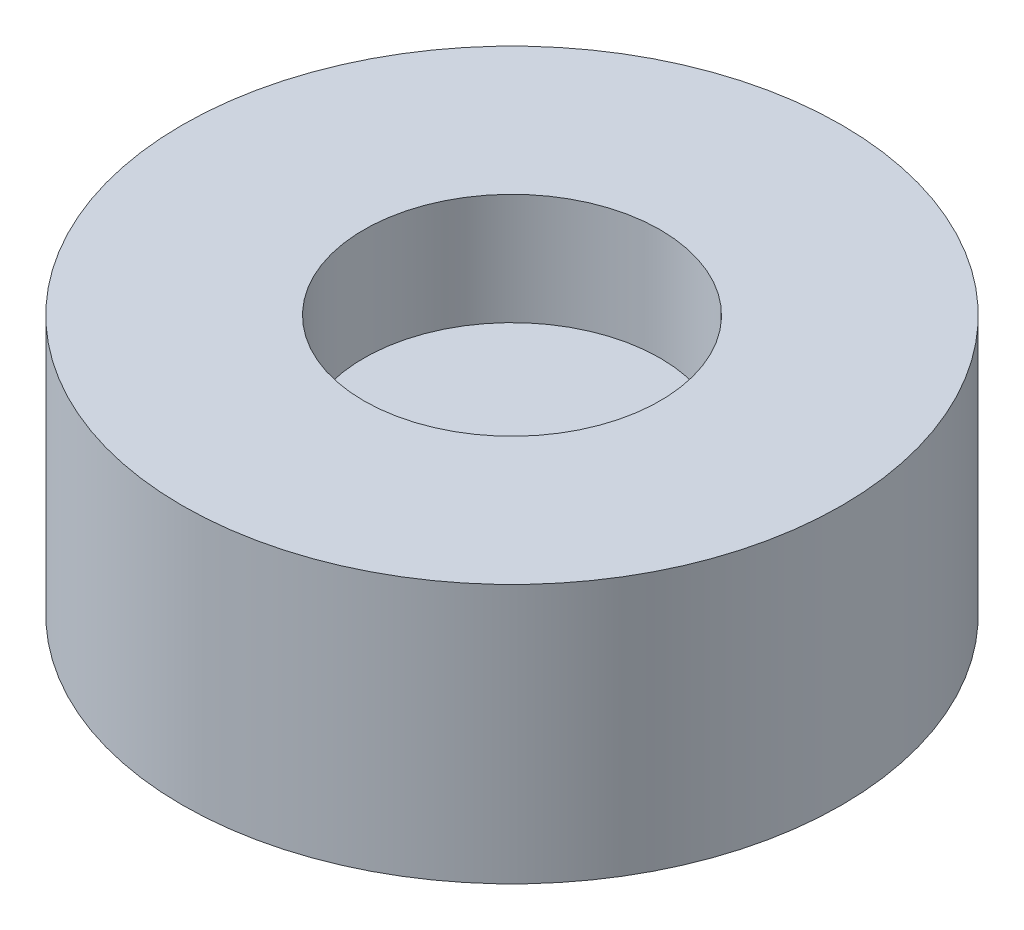
from build123d import *

# Parameters (mm, degrees)
SKETCH1_W          = 8.9
SKETCH1_H          = 7
SKETCH2_R          = 4
CUT_EXTRUDE1_DEPTH = 3


with BuildPart() as part:
    # Sketch1 → Revolve1 (revolve)
    with BuildSketch(Plane.XY):
        with Locations((-4.45, 4.5)):
            Rectangle(SKETCH1_W, SKETCH1_H)
    revolve(axis=Axis((0, 0, 0), (0, 1, 0)))

    # Sketch2 → Cut-Extrude1 (cut)
    with BuildSketch(Plane(origin=(0, 8, 0), x_dir=(1, 0, 0), z_dir=(0, 1, 0))):
        Circle(SKETCH2_R)
    extrude(amount=-CUT_EXTRUDE1_DEPTH, mode=Mode.SUBTRACT)


solid = part.part
